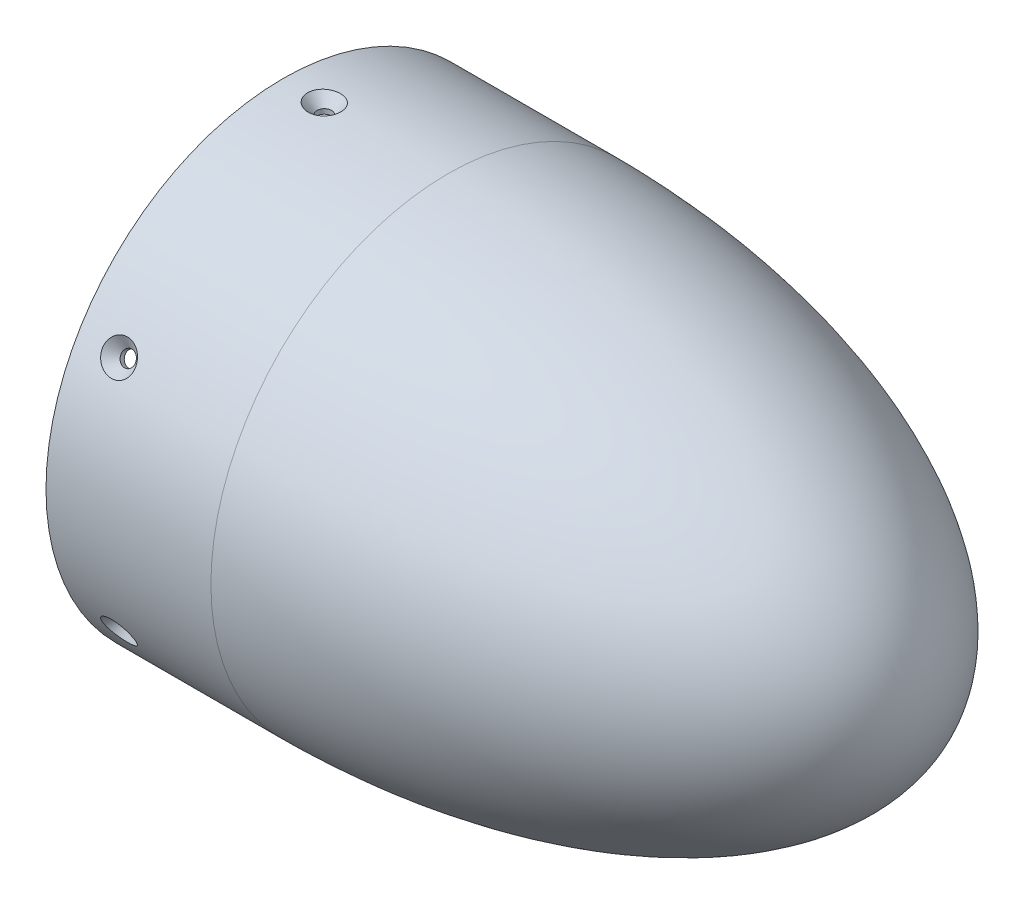
from build123d import *

# Parameters (mm, degrees)
SKETCH2_R           = 73.025
SKETCH2_R_2         = 63.5
BOSS_EXTRUDE1_DEPTH = 50.8
CUT_EXTRUDE2_START  = -25.4
SKETCH4_R           = 68.2625
SKETCH4_R_2         = 63.5
CUT_EXTRUDE2_DEPTH  = 25.4
CIRPATTERN1_COUNT   = 6
CHAMFER1_SIZE       = 1.27


with BuildPart() as part:
    # Sketch1 → Revolve1 (revolve)
    with BuildSketch(Plane.XY, mode=Mode.PRIVATE) as revolve1_sk:
        with BuildLine():
            Line((0, -63.5), (0, -73.025))
            add(Edge.make_bspline(
                [(0, -73.025), (146.05, -73.025), (146.05, 0)],
                knots=[4.71238898, 4.71238898, 4.71238898, 6.283185307, 6.283185307, 6.283185307], degree=2, weights=[1, 0.707106781, 1]))
            Line((146.05, 0), (134.332348419, 0))
            Line((134.332348419, 0), (127, -12.7))
            Line((127, -12.7), (120.65, -12.7))
            Line((120.65, -12.7), (120.65, -29.310966545))
            Line((120.65, -29.310966545), (101.6, -29.310966545))
            Line((101.6, -29.310966545), (101.6, -38.1))
            Line((101.6, -38.1), (76.2, -38.1))
            Line((76.2, -38.1), (76.2, -50.8))
            Line((76.2, -50.8), (50.8, -50.8))
            Line((50.8, -50.8), (50.8, -58.198711326))
            add(Edge.make_bspline(
                [(0, -63.5), (26.50644337, -63.5), (50.8, -58.198711326)],
                knots=[4.71238898, 4.71238898, 4.71238898, 5.123905826, 5.123905826, 5.123905826], degree=2, weights=[1, 0.978906313, 1]))
        make_face()
    revolve(revolve1_sk.sketch.rotate(Axis((134.332348419, 0, 0), (1, 0, 0)), 270), axis=Axis((134.332348419, 0, 0), (1, 0, 0)))

    # Sketch2 → Boss-Extrude1 (add)
    with BuildSketch(Plane.ZY):
        Circle(SKETCH2_R)
        with Locations(Location((0, 0, 0), (0, 0, 270))):
            Circle(SKETCH2_R_2, mode=Mode.SUBTRACT)
    extrude(amount=BOSS_EXTRUDE1_DEPTH)

    # Sketch4 → Cut-Extrude2 (cut)
    with BuildSketch(Plane.ZY.offset(50.8).offset(CUT_EXTRUDE2_START)):
        with Locations(Location((0, 0, 0), (0, 0, 270))):
            Circle(SKETCH4_R)
        with Locations(Location((0, 0, 0), (0, 0, 270))):
            Circle(SKETCH4_R_2, mode=Mode.SUBTRACT)
    extrude(amount=CUT_EXTRUDE2_DEPTH, mode=Mode.SUBTRACT)

    # Sketch7 → CSK for #8 Flat Head Socket Cap Screw1 (revolve, cut)
    with BuildSketch(Plane(origin=(-38.1, 73.025, 0), x_dir=(0, 0, 1), z_dir=(1, 0, 0))):
        Polygon((0, 0), (0, 26.750674586), (2.2479, 25.4), (2.2479, 3.293956615), (5.1112928, 0), align=None)
    csk_for_8_flat_head_socket_cap_screw1 = revolve(axis=Axis((-38.1, 79.375, 0), (0, -1, 0)), mode=Mode.SUBTRACT)

    # CirPattern1: CSK for #8 Flat Head Socket Cap Screw1 ×6 about axis
    cirpattern1_axis = Axis((-25.4, 0, 0), (-1, 0, 0))
    for i in range(1, CIRPATTERN1_COUNT):
        add(csk_for_8_flat_head_socket_cap_screw1.rotate(cirpattern1_axis, i * 360 / CIRPATTERN1_COUNT), mode=Mode.SUBTRACT)

    # Chamfer1
    chamfer1_edges = [part.edges().sort_by_distance(p)[0] for p in [
        (-50.8, 68.2625, 0),
    ]]
    chamfer(chamfer1_edges, length=CHAMFER1_SIZE)


solid = part.part
